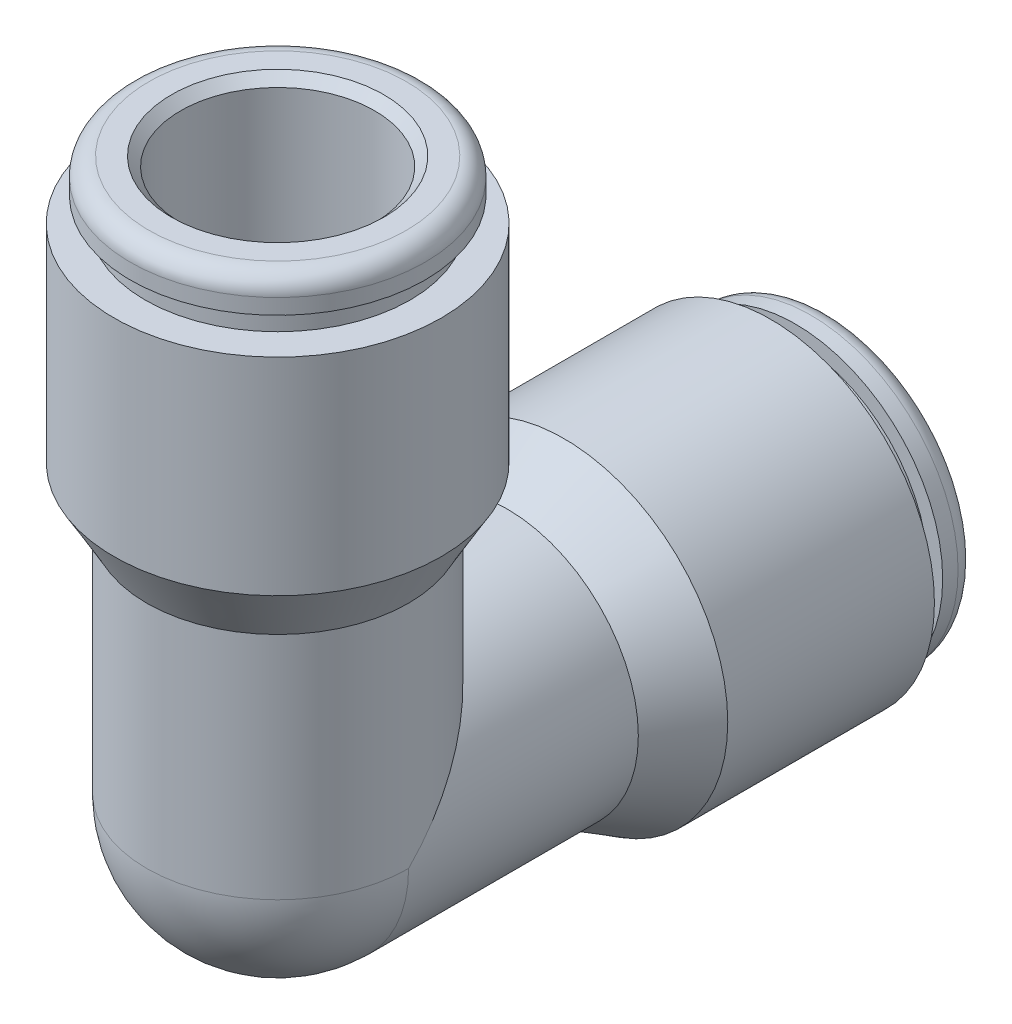
from build123d import *

# Parameters (mm, degrees)
CIRPATTERN1_COUNT = 2
CIRPATTERN1_ANGLE = 90
REVOLVE2_ANGLE    = 90
CIRPATTERN2_COUNT = 2
CIRPATTERN2_ANGLE = 90


with BuildPart() as part:
    # Sketch1 → Revolve1 (revolve)
    with BuildSketch(Plane(origin=(0, 0, 0), x_dir=(0, 0, -1), z_dir=(1, 0, 0)), mode=Mode.PRIVATE) as revolve1_sk:
        with BuildLine():
            Line((21.353, 6.075), (21.988, 6.075))
            ThreePointArc((21.988, 6.075), (22.526815367, 5.851815367), (22.75, 5.313))
            Line((22.75, 5.313), (22.75, 4.381))
            Line((22.75, 4.381), (22.369, 4))
            Line((22.369, 4), (8, 4))
            Line((8, 4), (8, 3.238))
            Line((8, 3.238), (0, 3.238))
            Line((0, 3.238), (0, 5.4))
            Line((0, 5.4), (9.475, 5.4))
            Line((9.475, 5.4), (11.81326859, 6.75))
            Line((11.81326859, 6.75), (20.337, 6.75))
            Line((20.337, 6.75), (20.337, 5.4675))
            Line((20.337, 5.4675), (21.353, 5.4675))
            Line((21.353, 5.4675), (21.353, 6.075))
        make_face()
    revolve(revolve1_sk.sketch.rotate(Axis((0, 0, 0), (0, 0, -1)), 90), axis=Axis((0, 0, 0), (0, 0, -1)))


with BuildPart() as cirpattern1_1:
    # CirPattern1: pattern copy
    add(part.part.rotate(Axis((-15.801937006, 0, 0), (1, 0, 0)), 1 * CIRPATTERN1_ANGLE / (CIRPATTERN1_COUNT - 1)))


with BuildPart() as part_1:
    add(part.part)

    # Sketch2 → Revolve2 (revolve)
    with BuildSketch(Plane.XY):
        with BuildLine():
            Line((-5.4, 0), (-3.238, 0))
            ThreePointArc((-3.238, 0), (0, -3.238), (3.238, 0))
            Line((3.238, 0), (5.4, 0))
            ThreePointArc((5.4, 0), (0, -5.4), (-5.4, 0))
        make_face()
    revolve(axis=Axis((-5.4, 0, 0), (-1, 0, 0)), revolution_arc=REVOLVE2_ANGLE)

    # Combine1: union CirPattern1_1
    add(cirpattern1_1.part)

    # Sketch3 → Cut-Revolve1 (revolve, cut)
    with BuildSketch(Plane(origin=(0, 0, 0), x_dir=(0, 0, -1), z_dir=(1, 0, 0)), mode=Mode.PRIVATE) as cut_revolve1_sk:
        Polygon((22.75, 4.381), (22.369, 4), (8, 4), (8, 3.238), (0, 3.238), (0, 0), (22.75, 0), align=None)
    cut_revolve1 = revolve(cut_revolve1_sk.sketch.rotate(Axis((0, 0, 0), (0, 0, -1)), 90), axis=Axis((0, 0, 0), (0, 0, -1)), mode=Mode.SUBTRACT)

    # CirPattern2: Cut-Revolve1 ×2 about axis
    cirpattern2_axis = Axis((-15.801937006, 0, 0), (1, 0, 0))
    for i in range(1, CIRPATTERN2_COUNT):
        add(cut_revolve1.rotate(cirpattern2_axis, i * CIRPATTERN2_ANGLE / (CIRPATTERN2_COUNT - 1)), mode=Mode.SUBTRACT)


solid = part_1.part
